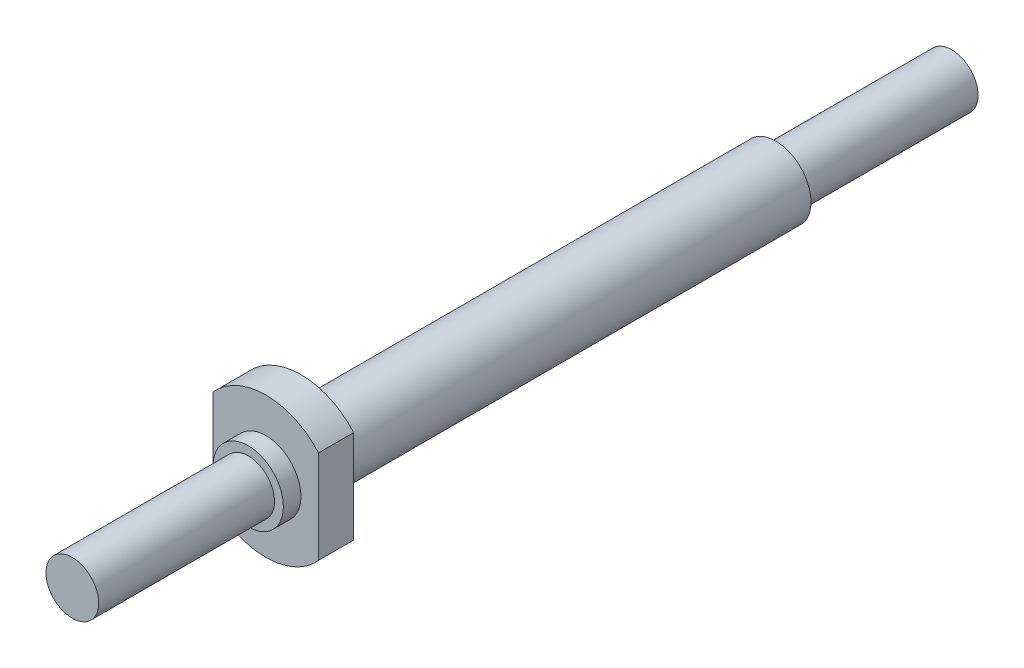
from build123d import *

# Parameters (mm, degrees)
EXTRUDE_1_DEPTH = 2
SKETCH_2_R      = 2
EXTRUDE_2_DEPTH = 1
SKETCH_3_R      = 1.5
EXTRUDE_3_DEPTH = 10
EXTRUDE_START   = 27
SKETCH_4_R      = 2
EXTRUDE_4_DEPTH = 27
EXTRUDE_START_2 = 10
SKETCH_5_R      = 1.5
EXTRUDE_5_DEPTH = 10


with BuildPart() as part:
    # 草图1 → 凸台-拉伸1 (new body)
    with BuildSketch(Plane.XY):
        with BuildLine():
            Line((-3, 2.645751311), (-3, -2.645751311))
            ThreePointArc((-3, -2.645751311), (0, -4), (3, -2.645751311))
            Line((3, -2.645751311), (3, 2.645751311))
            ThreePointArc((3, 2.645751311), (0, 4), (-3, 2.645751311))
        make_face()
    extrude(amount=EXTRUDE_1_DEPTH)

    # 草图2 → 凸台-拉伸2 (add)
    with BuildSketch(Plane.XY.offset(2)):
        Circle(SKETCH_2_R)
    extrude(amount=EXTRUDE_2_DEPTH)

    # 草图3 → 凸台-拉伸3 (add)
    with BuildSketch(Plane.XY.offset(3)):
        Circle(SKETCH_3_R)
    extrude(amount=EXTRUDE_3_DEPTH)

    # 草图4 → 凸台-拉伸4 (add)
    with BuildSketch(Plane(origin=(0, 0, 0), x_dir=(-1, 0, 0), z_dir=(0, 0, -1)).offset(EXTRUDE_START)):
        with Locations(Location((0, 0, 0), (0, 0, 180))):
            Circle(SKETCH_4_R)
    extrude(amount=-EXTRUDE_4_DEPTH)

    # 草图5 → 凸台-拉伸5 (add)
    with BuildSketch(Plane(origin=(0, 0, -27), x_dir=(-1, 0, 0), z_dir=(0, 0, -1)).offset(EXTRUDE_START_2)):
        with Locations(Location((0, 0, 0), (0, 0, 180))):
            Circle(SKETCH_5_R)
    extrude(amount=-EXTRUDE_5_DEPTH)


solid = part.part
